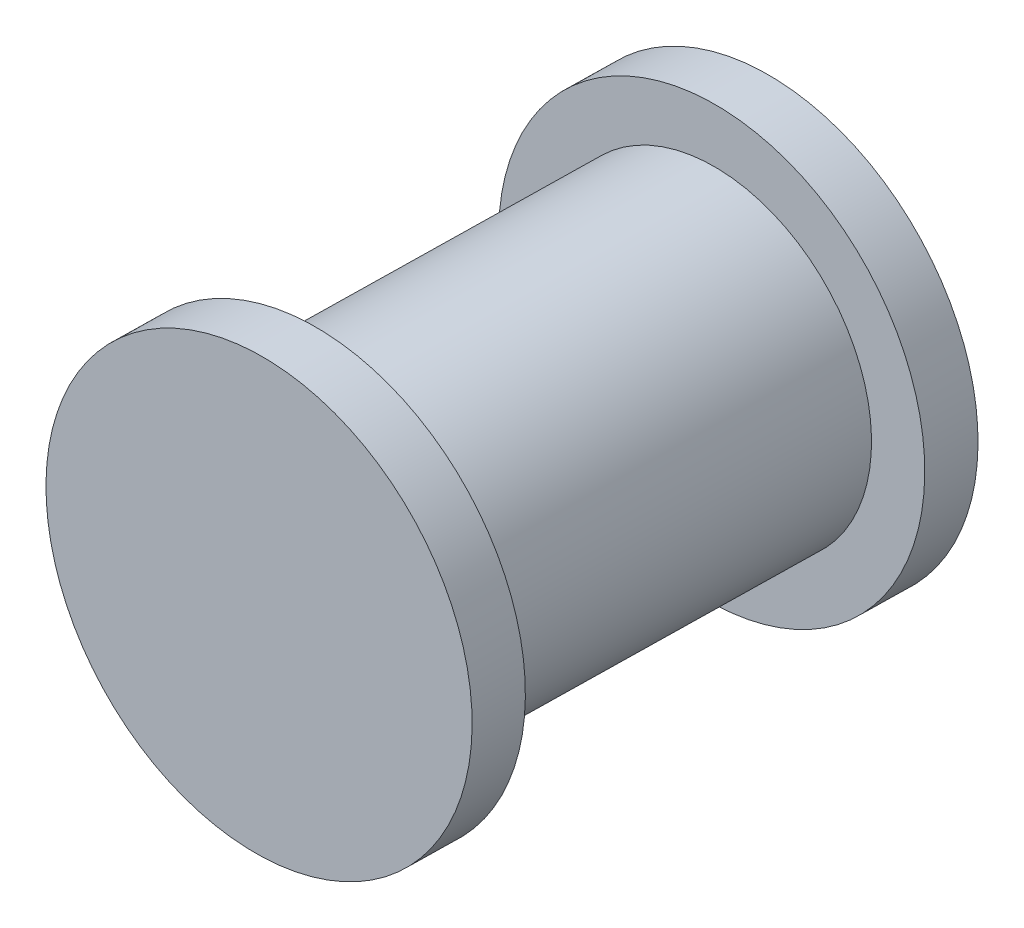
from build123d import *

# Parameters (mm, degrees)
BODY_MOVE_COPY1_ANGLE = 119.424338974


with BuildPart() as part:
    # Sketch1 → Revolve1 (revolve)
    with BuildSketch(Plane.XY, mode=Mode.PRIVATE) as revolve1_sk:
        Polygon((0, 0), (0, 9.5), (-4, 9.5), (-4, 8.5), (-3, 8.5), (-3, 1), (-4, 1), (-4, 0), align=None)
    revolve(revolve1_sk.sketch.rotate(Axis((0, 0, 0), (0, 1, 0)), 270), axis=Axis((0, 0, 0), (0, 1, 0)))


with BuildPart() as part_1:
    # Body-Move/Copy1: moved
    add(part.part.moved(Location((0, 0, 0))).rotate(Axis((-2.346629399, 4.612052575, -2.346629399), (0.5739619558891293, 0.5840679295973761, 0.5739619558888548)), BODY_MOVE_COPY1_ANGLE))


solid = part_1.part
